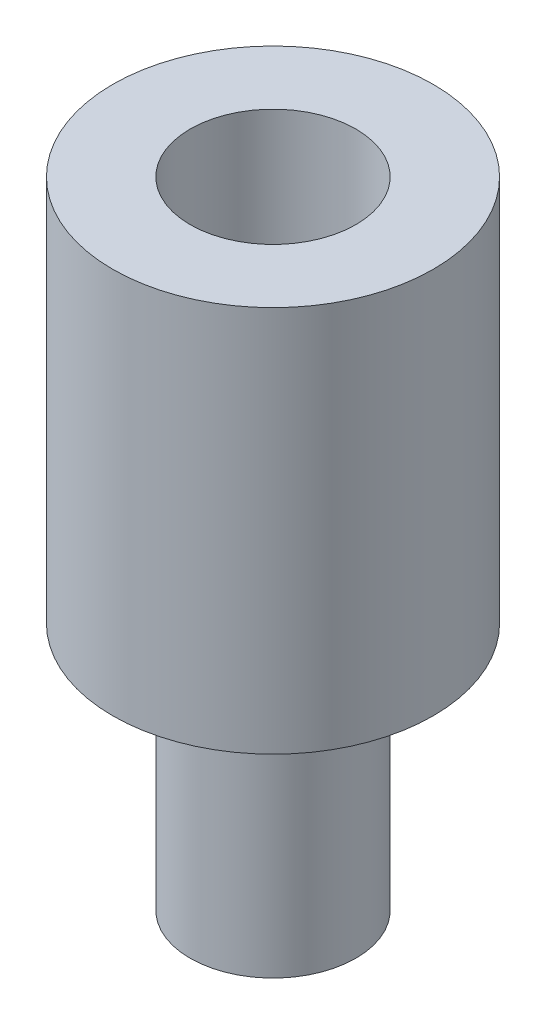
from build123d import *

# Parameters (mm, degrees)
SKETCH1_R           = 2.9
BOSS_EXTRUDE1_DEPTH = 7
SKETCH2_R           = 1.5
BOSS_EXTRUDE2_DEPTH = 4.5
SKETCH3_R           = 1.5
CUT_EXTRUDE1_DEPTH  = 4.5


with BuildPart() as part:
    # Sketch1 → Boss-Extrude1 (new body)
    with BuildSketch(Plane(origin=(0, 0, 0), x_dir=(1, 0, 0), z_dir=(0, 1, 0))):
        with Locations(Location((0, 0, 0), (0, 0, 270))):
            Circle(SKETCH1_R)
    extrude(amount=BOSS_EXTRUDE1_DEPTH)

    # Sketch2 → Boss-Extrude2 (add)
    with BuildSketch(Plane.XZ):
        with Locations(Location((0, 0, 0), (0, 0, 270))):
            Circle(SKETCH2_R)
    extrude(amount=BOSS_EXTRUDE2_DEPTH)

    # Sketch3 → Cut-Extrude1 (cut)
    with BuildSketch(Plane(origin=(0, 7, 0), x_dir=(1, 0, 0), z_dir=(0, 1, 0))):
        with Locations(Location((0, 0, 0), (0, 0, 90))):
            Circle(SKETCH3_R)
    extrude(amount=-CUT_EXTRUDE1_DEPTH, mode=Mode.SUBTRACT)


solid = part.part
